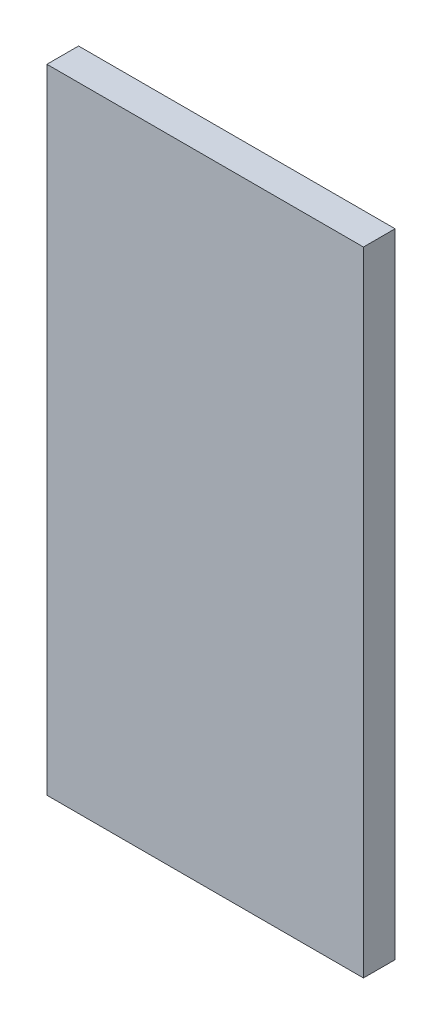
from build123d import *

# Parameters (mm, degrees)
SKETCH_1_W      = 300
SKETCH_1_H      = 600
EXTRUDE_1_DEPTH = 30


with BuildPart() as part:
    # Эскиз1 → Бобышка-Вытянуть1 (new body)
    with BuildSketch(Plane.XY):
        with Locations((132.624503416, 275.752105514)):
            Rectangle(SKETCH_1_W, SKETCH_1_H)
    extrude(amount=EXTRUDE_1_DEPTH)


solid = part.part
